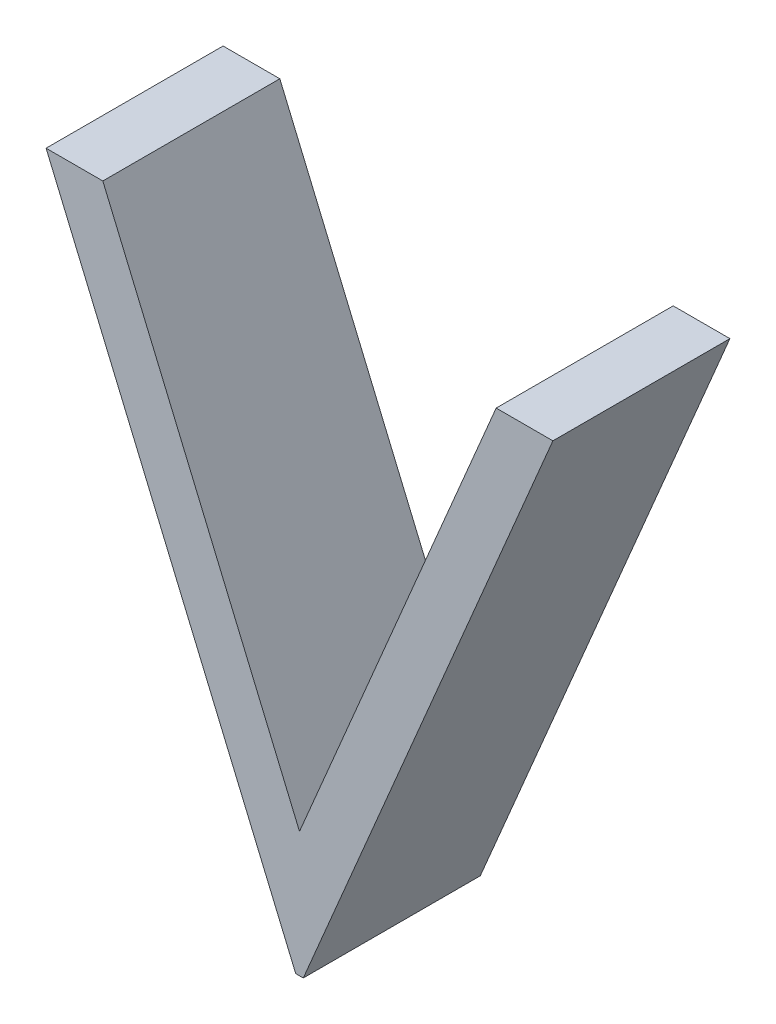
from build123d import *

# Parameters (mm, degrees)
BOSS_EXTRU_1_DEPTH = 1.5


with BuildPart() as part:
    # Esquisse1 → Boss.-Extru.1 (new body)
    with BuildSketch(Plane.XY):
        Polygon((-55.81708071, -17.870119076), (-55.33631148, -17.870119076), (-53.669644813, -21.810423563), (-52.002978146, -17.870119076), (-51.522208916, -17.870119076), (-53.637593531, -22.870119076), (-53.701696095, -22.870119076), align=None)
    extrude(amount=BOSS_EXTRU_1_DEPTH)


solid = part.part
